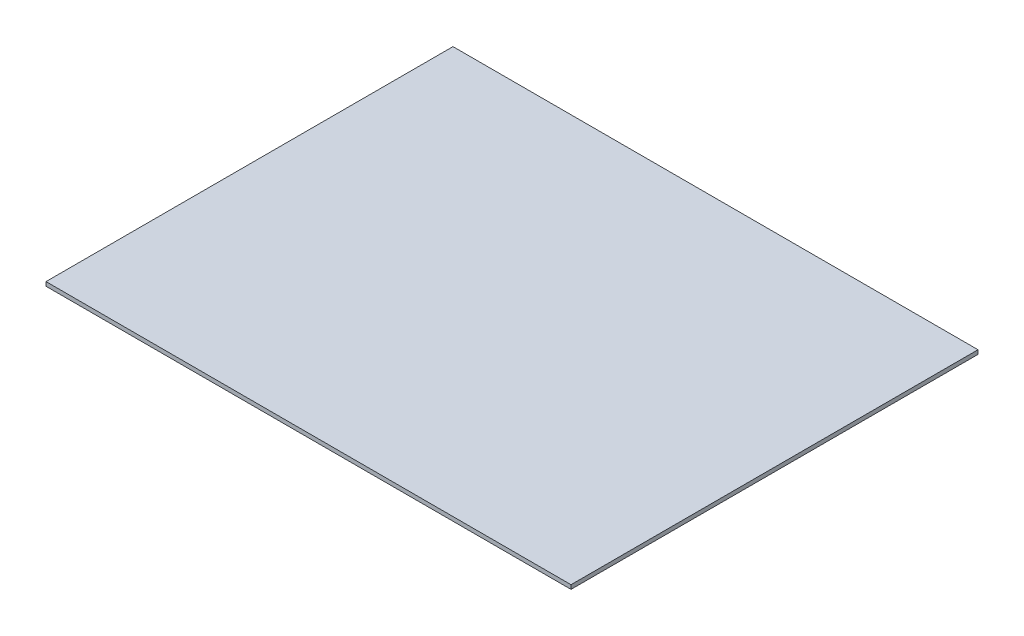
from build123d import *

# Parameters (mm, degrees)
SKETCH1_W          = 645
SKETCH1_H          = 5
BASE_EXTRUDE_DEPTH = 500


with BuildPart() as part:
    # Sketch1 → Base-Extrude (new body)
    with BuildSketch(Plane.XY):
        with Locations((0, -57.5)):
            Rectangle(SKETCH1_W, SKETCH1_H)
    extrude(amount=BASE_EXTRUDE_DEPTH)


solid = part.part
